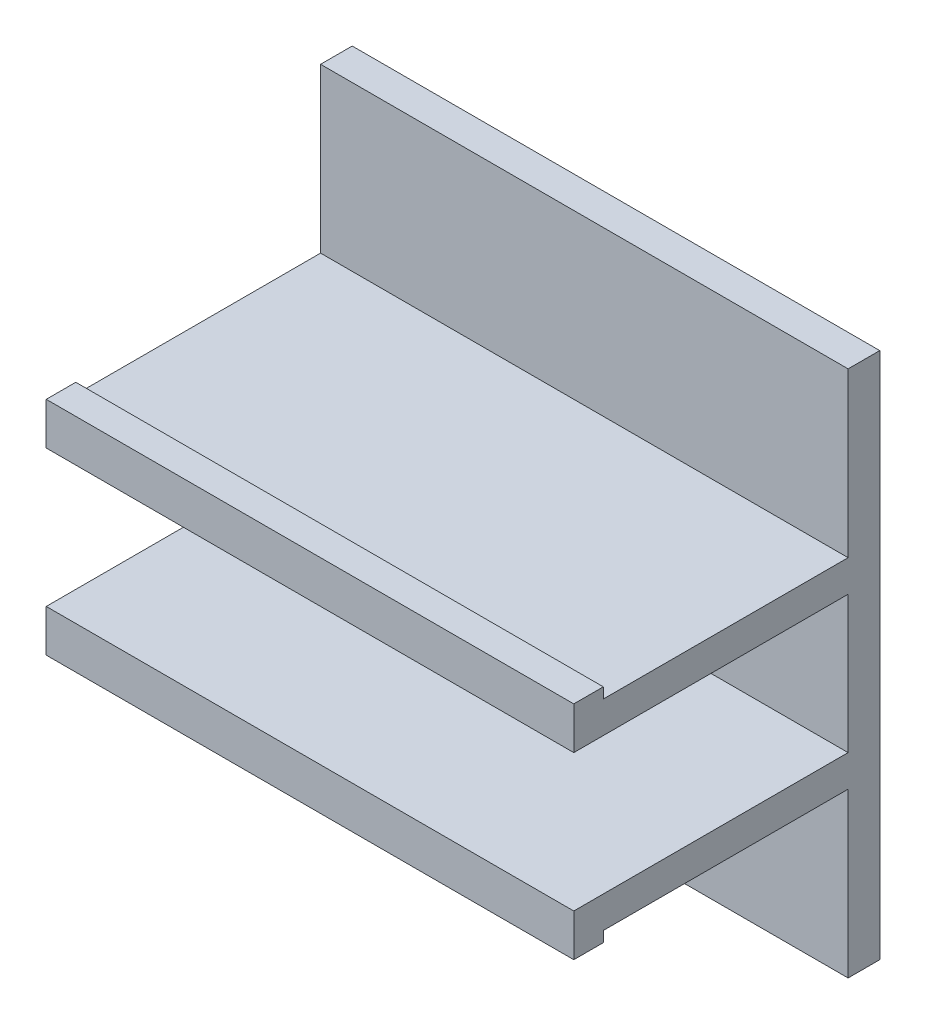
from build123d import *

# Parameters (mm, degrees)
SKETCH_1_W          = 25
SKETCH_1_H          = 25
EXTRUDE_1_DEPTH     = 14.5
SKETCH_2_W          = 25
SKETCH_2_H          = 7.25
SKETCH_2_H_2        = 6.5
CUT_EXTRUDE_1_DEPTH = 13
SKETCH_3_W          = 25
SKETCH_3_H          = 0.5
CUT_EXTRUDE_2_DEPTH = 11.6


with BuildPart() as part:
    # Эскиз1 → Бобышка-Вытянуть1 (new body)
    with BuildSketch(Plane.XY):
        with Locations((12.5, 12.5)):
            Rectangle(SKETCH_1_W, SKETCH_1_H)
    extrude(amount=EXTRUDE_1_DEPTH)

    # Эскиз2 → Вырез-Вытянуть1 (cut)
    with BuildSketch(Plane.XY.offset(14.5)):
        with Locations((12.5, 21.375)):
            Rectangle(SKETCH_2_W, SKETCH_2_H)
        with Locations((12.5, 12.5)):
            Rectangle(SKETCH_2_W, SKETCH_2_H_2)
        with Locations((12.5, 3.625)):
            Rectangle(SKETCH_2_W, SKETCH_2_H)
    extrude(amount=-CUT_EXTRUDE_1_DEPTH, mode=Mode.SUBTRACT)

    # Эскиз3 → Вырез-Вытянуть2 (cut)
    with BuildSketch(Plane.XY.offset(1.5)):
        with Locations((12.5, 17.5)):
            Rectangle(SKETCH_3_W, SKETCH_3_H)
        with Locations((12.5, 7.5)):
            Rectangle(SKETCH_3_W, SKETCH_3_H)
    extrude(amount=CUT_EXTRUDE_2_DEPTH, mode=Mode.SUBTRACT)


solid = part.part
